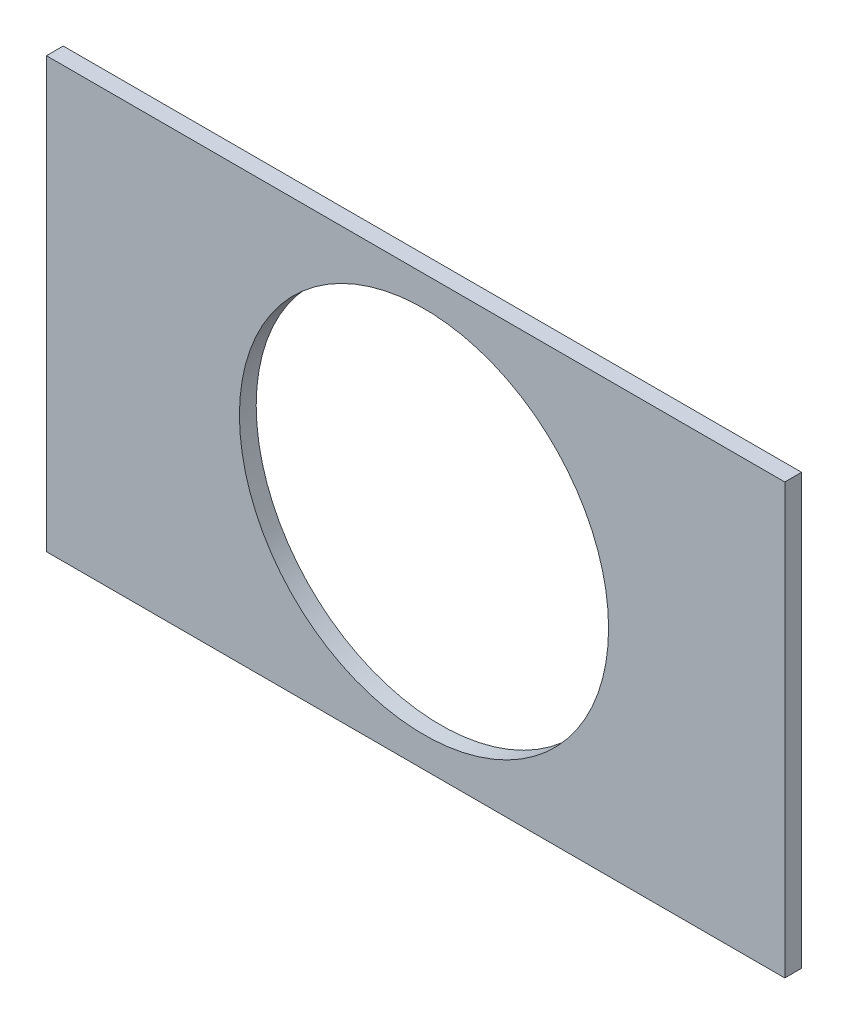
from build123d import *

# Parameters (mm, degrees)
SKETCH1_W           = 279.4
SKETCH1_H           = 162.56
SKETCH1_R           = 69.85
BOSS_EXTRUDE1_DEPTH = 6.35


with BuildPart() as part:
    # Sketch1 → Boss-Extrude1 (new body)
    with BuildSketch(Plane.XY):
        with Locations((139.7, -81.28)):
            Rectangle(SKETCH1_W, SKETCH1_H)
        with Locations((142.875, -81.28)):
            Circle(SKETCH1_R, mode=Mode.SUBTRACT)
    extrude(amount=BOSS_EXTRUDE1_DEPTH)


solid = part.part
